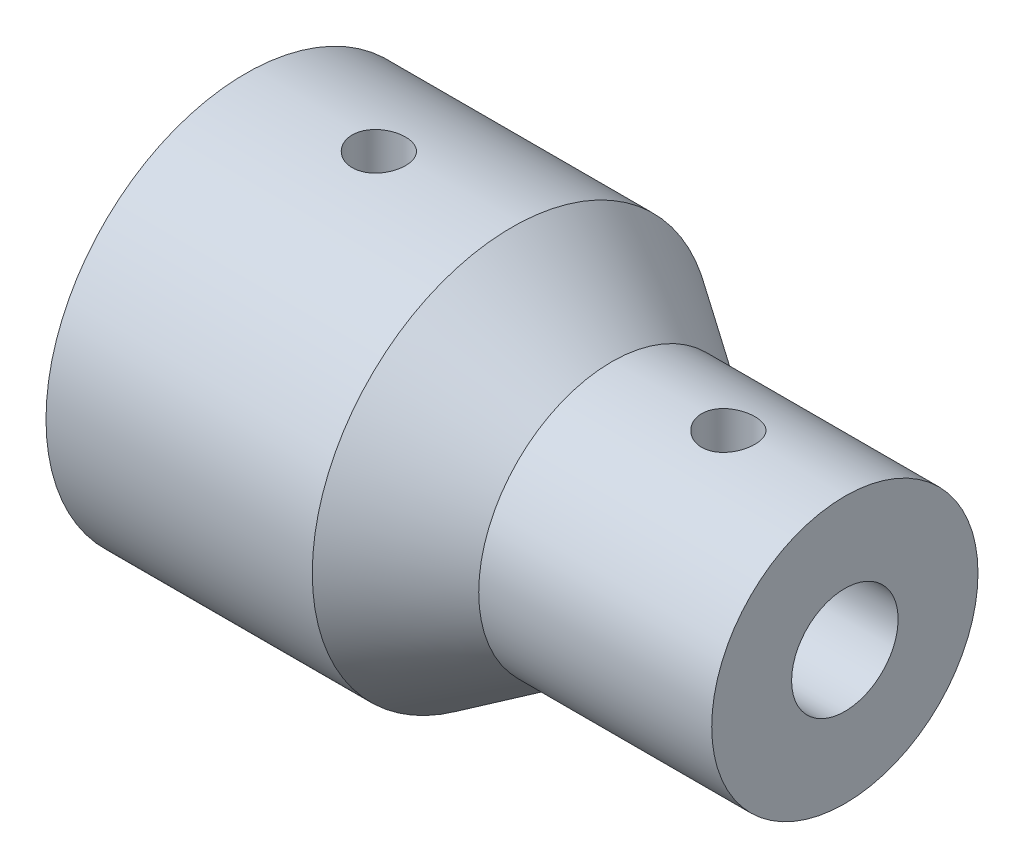
from build123d import *

# Parameters (mm, degrees)
SKETCH2_R          = 1.016
CUT_EXTRUDE1_DEPTH = 17.655893852
CIRPATTERN1_COUNT  = 2
CIRPATTERN1_ANGLE  = 90


with BuildPart() as part:
    # Sketch1 → Revolve1 (revolve)
    with BuildSketch(Plane(origin=(0, 0, 0), x_dir=(1, 0, 0), z_dir=(0, 1, 0)), mode=Mode.PRIVATE) as revolve1_sk:
        Polygon((-10.16, 3.3655), (0, 3.3655), (2.309689752, 2.032), (12.7, 2.032), (12.7, 5.08), (3.81, 5.08), (0, 7.62), (-10.16, 7.62), align=None)
    revolve(revolve1_sk.sketch.rotate(Axis((0, 0, 0), (1, 0, 0)), 180), axis=Axis((0, 0, 0), (1, 0, 0)))

    # Sketch2 → Cut-Extrude1 (cut, through all)
    with BuildSketch(Plane(origin=(0, 0, 0), x_dir=(1, 0, 0), z_dir=(0, 1, 0))):
        with Locations(Location((-5.08, 0, 0), (0, 0, 90))):
            Circle(SKETCH2_R)
        with Locations(Location((8.255, 0, 0), (0, 0, 90))):
            Circle(SKETCH2_R)
    cut_extrude1 = extrude(amount=CUT_EXTRUDE1_DEPTH, mode=Mode.SUBTRACT)

    # CirPattern1: Cut-Extrude1 ×2 about axis
    cirpattern1_axis = Axis((-10.16, 0, 0), (-1, 0, 0))
    for i in range(1, CIRPATTERN1_COUNT):
        add(cut_extrude1.rotate(cirpattern1_axis, i * CIRPATTERN1_ANGLE / (CIRPATTERN1_COUNT - 1)), mode=Mode.SUBTRACT)


solid = part.part
